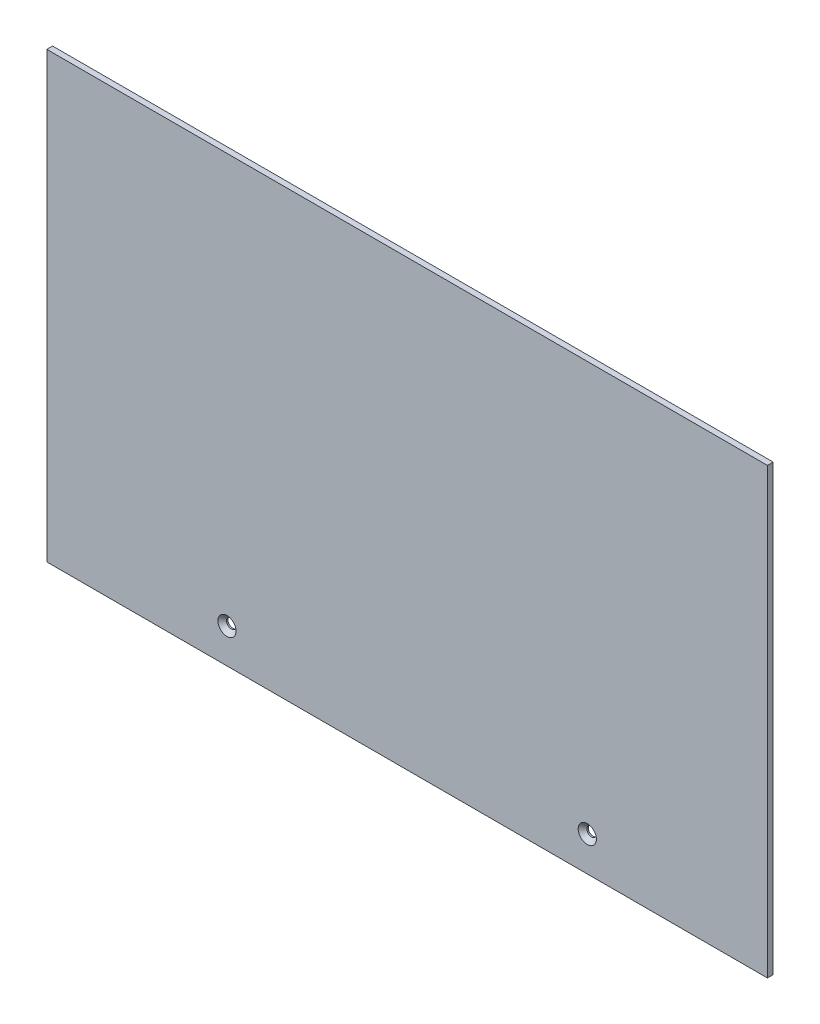
from build123d import *

# Parameters (mm, degrees)
SKETCH1_W                                    = 500
SKETCH1_H                                    = 308
BOSS_EXTRUDE1_DEPTH                          = 2
CSK_FOR_M6_COUNTERSUNK_FLAT_HEAD_SCR_2_COUNT = 2
CSK_FOR_M6_COUNTERSUNK_FLAT_HEAD_SCR_2_PITCH = 250


with BuildPart() as part:
    # Sketch1 → Boss-Extrude1 (new, symmetric)
    with BuildSketch(Plane.XY):
        with Locations((0, 154)):
            Rectangle(SKETCH1_W, SKETCH1_H)
    extrude(amount=BOSS_EXTRUDE1_DEPTH, both=True)

    # Sketch6 → CSK for M6 Countersunk Flat Head Screw2 (revolve, cut)
    with BuildSketch(Plane(origin=(-125, 24, 2), x_dir=(0, -1, 0), z_dir=(1, 0, 0))):
        Polygon((0, 0), (0, 4), (3.3, 4), (3.3, 3), (6.3, 0), align=None)
    csk_for_m6_countersunk_flat_head_screw2 = revolve(axis=Axis((-125, 24, 8.35), (0, 0, -1)), mode=Mode.SUBTRACT)

    # CSK for M6 Countersunk Flat Head Scr 2: CSK for M6 Countersunk Flat Head Screw2 ×2
    with Locations(*[(i * CSK_FOR_M6_COUNTERSUNK_FLAT_HEAD_SCR_2_PITCH, 0, 0) for i in range(1, CSK_FOR_M6_COUNTERSUNK_FLAT_HEAD_SCR_2_COUNT)]):
        add(csk_for_m6_countersunk_flat_head_screw2, mode=Mode.SUBTRACT)


solid = part.part
